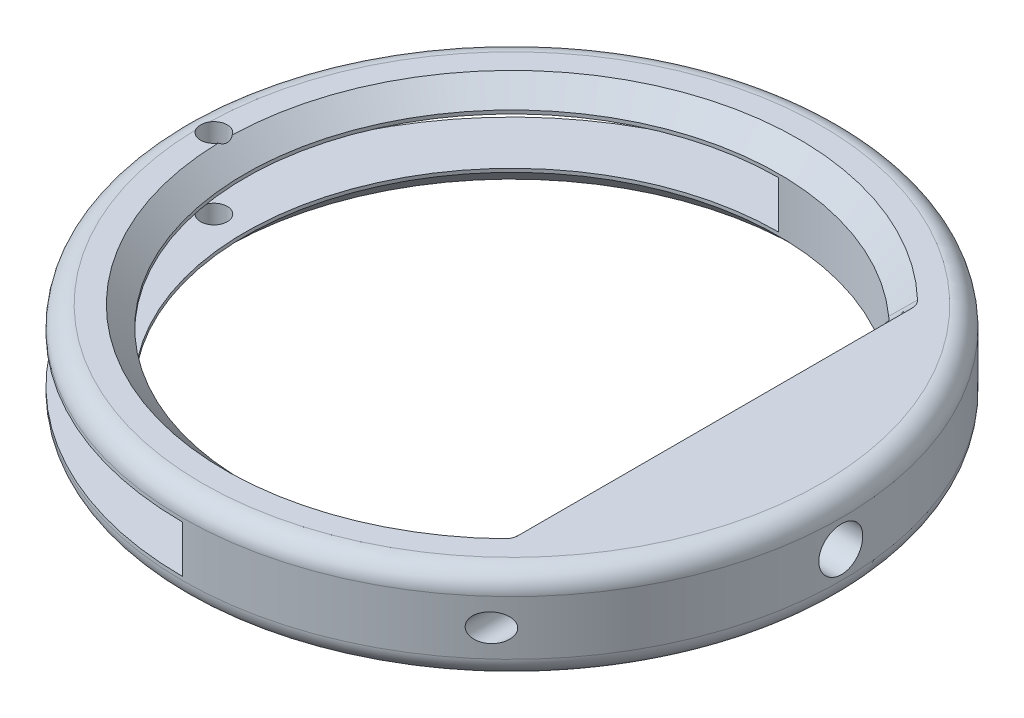
from build123d import *

# Parameters (mm, degrees)
SKETCH1_R               = 21
SKETCH1_R_2             = 17
BOSS_EXTRUDE1_DEPTH     = 6
SKETCH2_W               = 42
SKETCH2_H               = 3
CUT_EXTRUDE1_DEPTH      = 25.812
SKETCH3_W               = 34
SKETCH3_H               = 6
SKETCH3_W_2             = 33.201655863
SKETCH3_H_2             = 2.84
BOSS_EXTRUDE2_DEPTH     = 5.334
CUT_EXTRUDE2_START      = -19.05
SKETCH4_R               = 24.04163056
SKETCH4_R_2             = 21
CUT_EXTRUDE2_DEPTH      = 19.05
SKETCH5_R               = 1.4
CUT_EXTRUDE3_DEPTH      = 19.05
CHAMFER1_SIZE           = 1.279400032
CHAMFER2_SIZE           = 1.279400032
FILLET2_R               = 1.27
SKETCH8_R               = 0.85
CUT_EXTRUDE7_DEPTH      = 15.494
FILLET3_R               = 1.27
CUT_EXTRUDE8_DEPTH      = 19.812
CUT_EXTRUDE8_DEPTH_BACK = 28.194
SKETCH9_R               = 0.875


with BuildPart() as part:
    # Sketch1 → Boss-Extrude1 (new body)
    with BuildSketch(Plane(origin=(0, 0, 0), x_dir=(1, 0, 0), z_dir=(0, 1, 0))):
        with Locations(Location((0, 0, 0), (0, 0, 270))):
            Circle(SKETCH1_R)
        with Locations(Location((0, 0, 0), (0, 0, 270))):
            Circle(SKETCH1_R_2, mode=Mode.SUBTRACT)
    extrude(amount=BOSS_EXTRUDE1_DEPTH)

    # Sketch2 → Cut-Extrude1 (cut)
    with BuildSketch(Plane(origin=(0, 0, 0), x_dir=(0, 0, -1), z_dir=(1, 0, 0))):
        with Locations((0, 3)):
            Rectangle(SKETCH2_W, SKETCH2_H)
    extrude(amount=-CUT_EXTRUDE1_DEPTH, mode=Mode.SUBTRACT)

    # Sketch3 → Boss-Extrude2 (add)
    with BuildSketch(Plane.ZY.offset(-17)):
        with Locations((0, 3)):
            Rectangle(SKETCH3_W, SKETCH3_H)
        with Locations((0.110091931, 2.900051081)):
            Rectangle(SKETCH3_W_2, SKETCH3_H_2, mode=Mode.SUBTRACT)
    extrude(amount=BOSS_EXTRUDE2_DEPTH)

    # Sketch4 → Cut-Extrude2 (cut)
    with BuildSketch(Plane(origin=(0, 6, 0), x_dir=(1, 0, 0), z_dir=(0, 1, 0)).offset(CUT_EXTRUDE2_START)):
        Circle(SKETCH4_R)
        with Locations(Location((0, 0, 0), (0, 0, 270))):
            Circle(SKETCH4_R_2, mode=Mode.SUBTRACT)
    extrude(amount=CUT_EXTRUDE2_DEPTH, mode=Mode.SUBTRACT)

    # Sketch5 → Cut-Extrude3 (cut)
    with BuildSketch(Plane(origin=(21, 0, 0), x_dir=(0, 0, -1), z_dir=(1, 0, 0))):
        with Locations((0, 3)):
            Circle(SKETCH5_R)
    extrude(amount=-CUT_EXTRUDE3_DEPTH, mode=Mode.SUBTRACT)

    # Chamfer1
    chamfer1_edges = [part.edges().sort_by_distance(p)[0] for p in [
        (11.666, 6, 0),
        (11.666, 0, 0),
    ]]
    chamfer(chamfer1_edges, length=CHAMFER1_SIZE)

    # Chamfer2
    chamfer2_edges = [part.edges().sort_by_distance(p)[0] for p in [
        (-15.432460197, 0, -7.130159344),
        (-15.432460197, 6, -7.130159344),
    ]]
    chamfer(chamfer2_edges, length=CHAMFER2_SIZE)

    # Fillet2
    fillet2_edges = [part.edges().sort_by_distance(p)[0] for p in [
        (-12.328828006, 6, -17),
        (-12.328828006, 0, -17),
    ]]
    fillet(fillet2_edges, radius=FILLET2_R)

    # Sketch8 → Cut-Extrude7 (cut)
    with BuildSketch(Plane(origin=(0, 6, 0), x_dir=(1, 0, 0), z_dir=(0, 1, 0))):
        with Locations(Location((-18.993118417, 0, 0), (0, 0, 327.808132049))):
            Circle(SKETCH8_R)
    extrude(amount=-CUT_EXTRUDE7_DEPTH, mode=Mode.SUBTRACT)

    # Fillet3
    fillet3_edges = [part.edges().sort_by_distance(p)[0] for p in [
        (12.305140757, 0.640259275, 12.638148503),
        (12.305140757, 0.640259275, -12.638148503),
        (12.305140757, 5.359740725, 12.638148503),
        (12.305140757, 5.359740725, -12.638148503),
    ]]
    fillet(fillet3_edges, radius=FILLET3_R)

    # Sketch9 → Cut-Extrude8 (cut, two sides: drawn at the far end of the back side and taken through both)
    with BuildSketch(Plane.XY.offset(-CUT_EXTRUDE8_DEPTH_BACK)):
        with Locations(Location((14.157633808, 3, 0), (0, 0, 180))):
            Circle(SKETCH9_R)
    extrude(amount=CUT_EXTRUDE8_DEPTH + CUT_EXTRUDE8_DEPTH_BACK, mode=Mode.SUBTRACT)


solid = part.part
